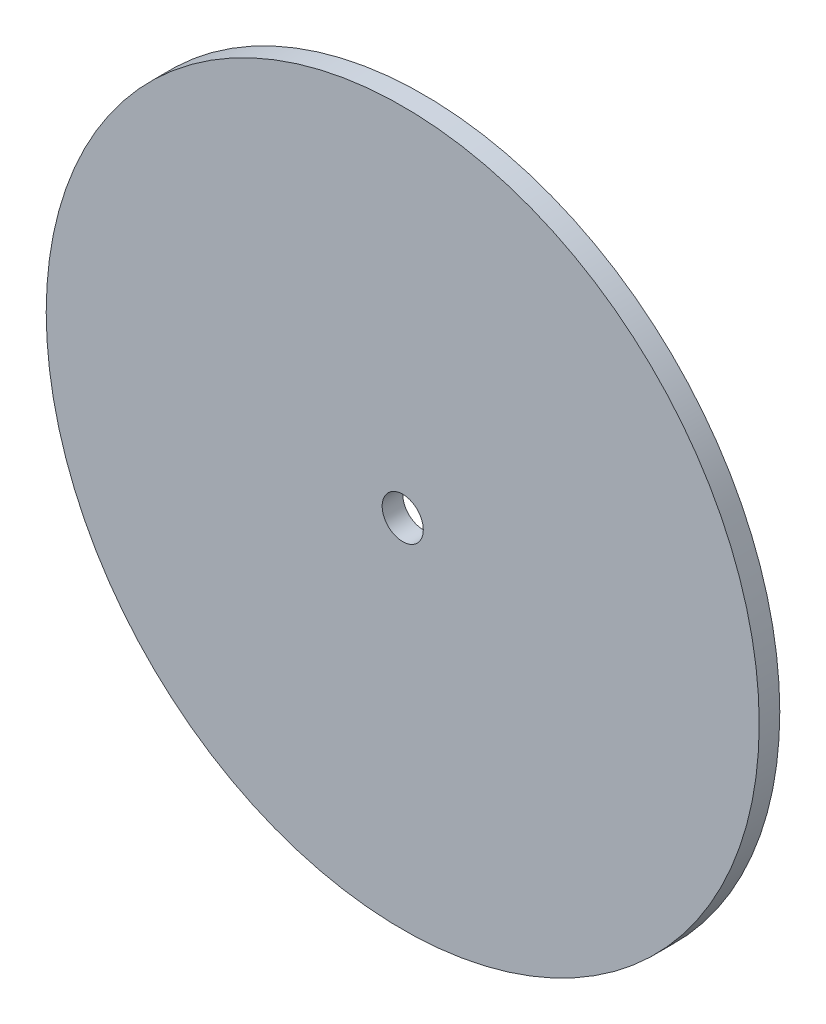
from build123d import *

# Parameters (mm, degrees)
SKETCH_1_R      = 52
SKETCH_1_R_2    = 3
EXTRUDE_1_DEPTH = 3


with BuildPart() as part:
    # 草图1 → 凸台-拉伸1 (new body)
    with BuildSketch(Plane.XY):
        Circle(SKETCH_1_R)
        Circle(SKETCH_1_R_2, mode=Mode.SUBTRACT)
    extrude(amount=EXTRUDE_1_DEPTH)


solid = part.part
